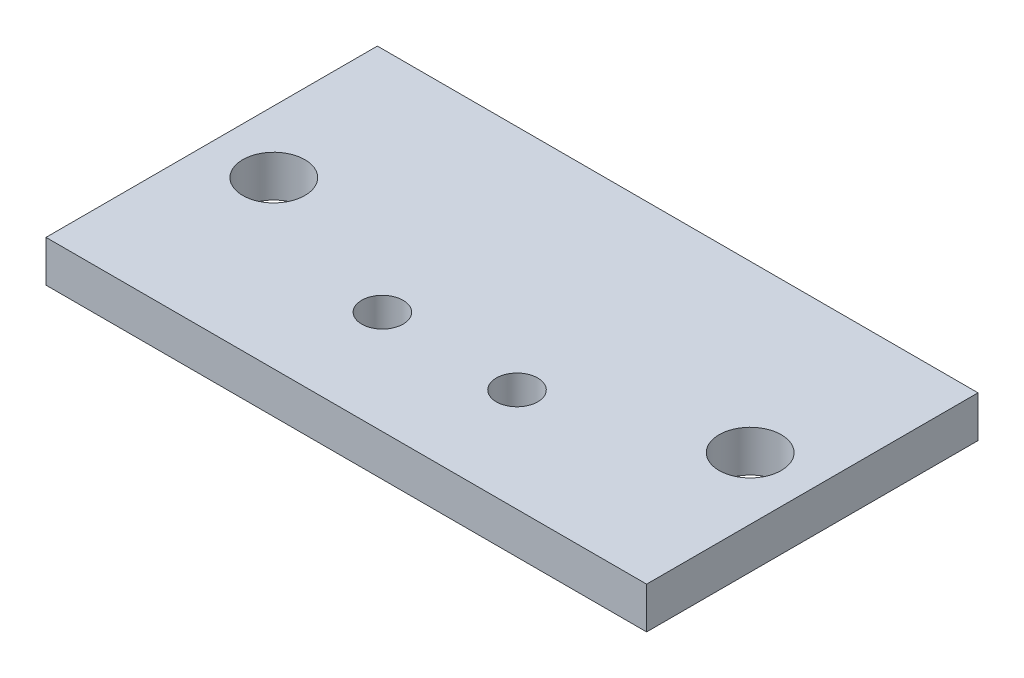
from build123d import *

# Parameters (mm, degrees)
CROQUIS1_W              = 29
CROQUIS1_H              = 16
CROQUIS1_R              = 1.5
CROQUIS1_R_2            = 1
SALIENTE_EXTRUIR1_DEPTH = 2


with BuildPart() as part:
    # Croquis1 → Saliente-Extruir1 (new body)
    with BuildSketch(Plane(origin=(0, 0, 0), x_dir=(1, 0, 0), z_dir=(0, 1, 0))):
        Rectangle(CROQUIS1_W, CROQUIS1_H)
        with Locations(Location((11.5, 0, 0), (0, 0, 270))):
            Circle(CROQUIS1_R, mode=Mode.SUBTRACT)
        with Locations(Location((-11.5, 0, 0), (0, 0, 90))):
            Circle(CROQUIS1_R, mode=Mode.SUBTRACT)
        with Locations(Location((-3.25, -3.007748766, 0), (0, 0, 270))):
            Circle(CROQUIS1_R_2, mode=Mode.SUBTRACT)
        with Locations(Location((3.25, -3.007748766, 0), (0, 0, 90))):
            Circle(CROQUIS1_R_2, mode=Mode.SUBTRACT)
    extrude(amount=SALIENTE_EXTRUIR1_DEPTH)


solid = part.part
